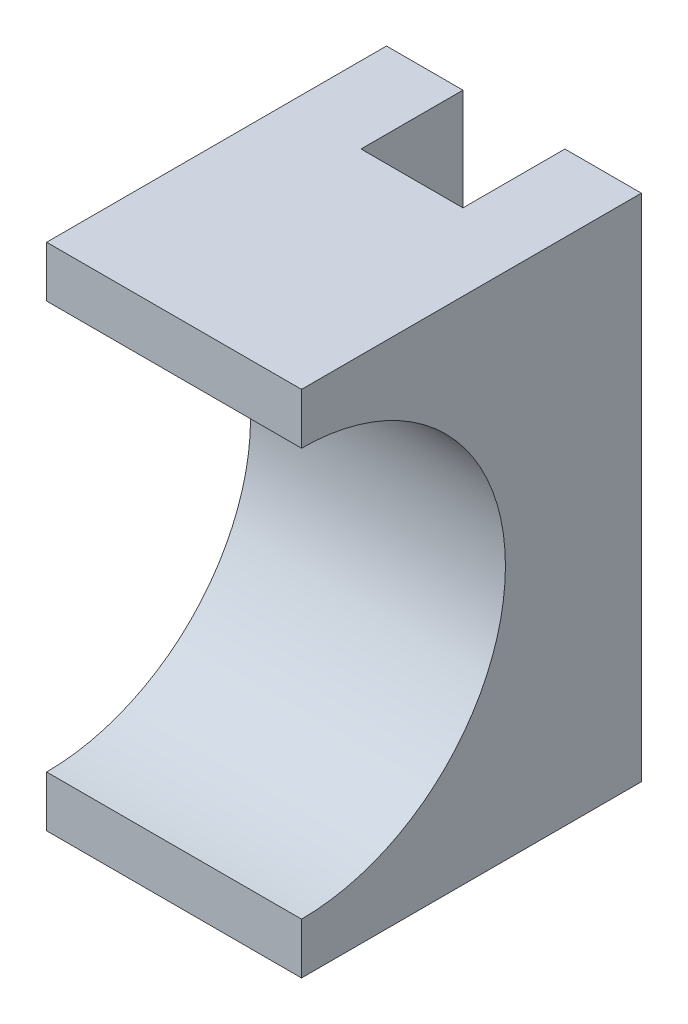
from build123d import *

# Parameters (mm, degrees)
SKETCH1_W           = 15
SKETCH1_H           = 20
BOSS_EXTRUDE1_DEPTH = 30
CUT_EXTRUDE1_REACH  = 37
SKETCH4_W           = 6
SKETCH4_H           = 6
CUT_EXTRUDE4_DEPTH  = 25
CUT_EXTRUDE2_REACH  = 34.5
SKETCH3_R           = 1.1


with BuildPart() as part:
    # Sketch1 → Boss-Extrude1 (new body)
    with BuildSketch(Plane(origin=(0, 0, 0), x_dir=(1, 0, 0), z_dir=(0, 1, 0))):
        Rectangle(SKETCH1_W, SKETCH1_H)
    extrude(amount=BOSS_EXTRUDE1_DEPTH)

    # Sketch2 → Cut-Extrude1 (cut, up to next)
    with BuildSketch(Plane(origin=(7.5, 0, 0), x_dir=(0, 0, -1), z_dir=(1, 0, 0)), mode=Mode.PRIVATE) as cut_extrude1_sk1:
        with BuildLine():
            Line((-10, 3), (-10, 27))
            ThreePointArc((-10, 27), (2, 15), (-10, 3))
        make_face()
    cut_extrude1_tool1 = extrude(cut_extrude1_sk1.sketch, amount=-CUT_EXTRUDE1_REACH, mode=Mode.PRIVATE) & part.part
    add(cut_extrude1_tool1.solids().sort_by_distance((7.5, 15, 4.907042))[0], mode=Mode.SUBTRACT)

    # Sketch4 → Cut-Extrude4 (cut)
    with BuildSketch(Plane(origin=(0, 30, 0), x_dir=(1, 0, 0), z_dir=(0, 1, 0))):
        with Locations((0, 7)):
            Rectangle(SKETCH4_W, SKETCH4_H)
    extrude(amount=-CUT_EXTRUDE4_DEPTH, mode=Mode.SUBTRACT)

    # Sketch3 → Cut-Extrude2 (cut, up to next)
    with BuildSketch(Plane(origin=(0, 30, 0), x_dir=(1, 0, 0), z_dir=(0, 1, 0)), mode=Mode.PRIVATE) as cut_extrude2_sk1:
        with Locations(Location((0, 7, 0), (0, 0, 270))):
            Circle(SKETCH3_R)
    cut_extrude2_tool1 = extrude(cut_extrude2_sk1.sketch, amount=-CUT_EXTRUDE2_REACH, mode=Mode.PRIVATE) & part.part
    add(cut_extrude2_tool1.solids().sort_by_distance((0, 30, -7))[0], mode=Mode.SUBTRACT)


solid = part.part
